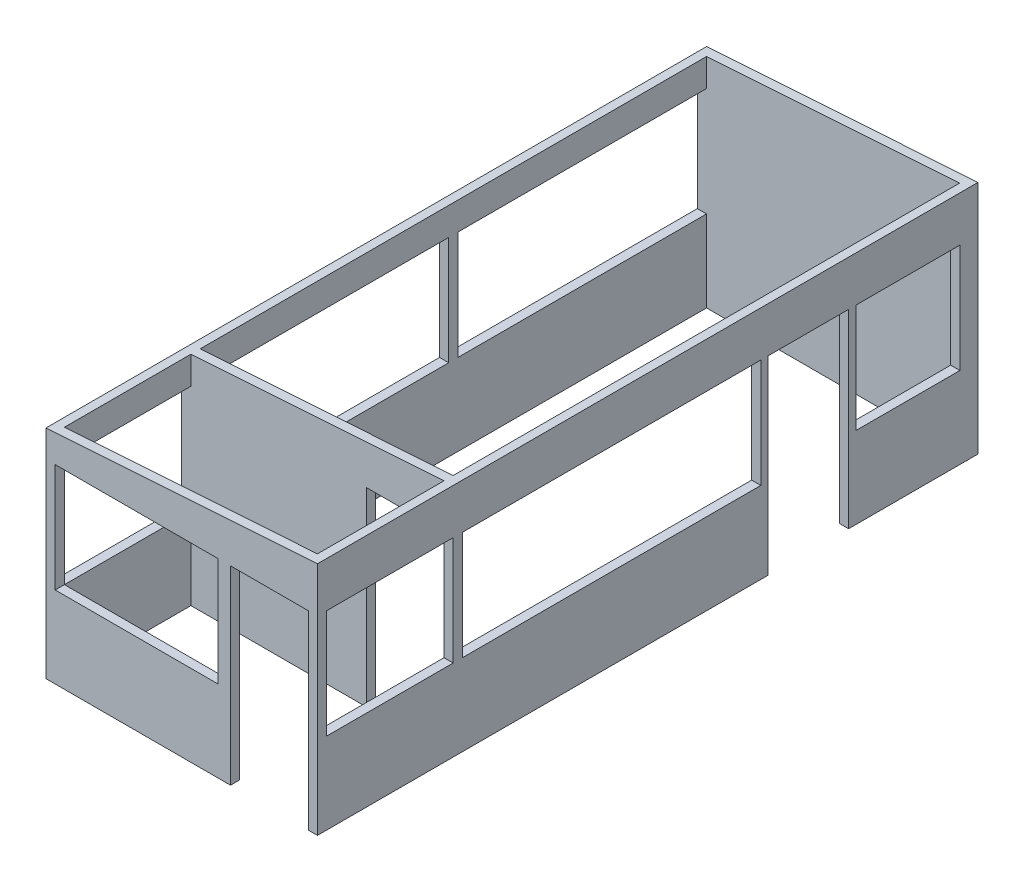
from build123d import *

# Parameters (mm, degrees)
CROQUIS1_W              = 3000
CROQUIS1_H              = 2600
SALIENTE_EXTRUIR1_DEPTH = 5800
CORTAR_EXTRUIR1_DEPTH   = 5800
CROQUIS4_W              = 2747.6
CROQUIS4_H              = 1200
CORTAR_EXTRUIR2_DEPTH   = 101.6
CROQUIS6_W              = 2796.8
CROQUIS6_H              = 5596.8
CORTAR_EXTRUIR5_DEPTH   = 3000
SALIENTE_EXTRUIR3_DEPTH = 1500
CROQUIS14_W             = 2796.8
CROQUIS14_H             = 1398.4
CORTAR_EXTRUIR7_DEPTH   = 3000
CORTAR_EXTRUIR8_REACH   = 8311.633
CROQUIS15_W             = 858.853595779
CROQUIS15_H             = 2100
CROQUIS16_W             = 1398.4
CROQUIS16_H             = 1200
CORTAR_EXTRUIR9_DEPTH   = 200
CROQUIS17_W             = 1797.946404221
CROQUIS17_H             = 1200
CORTAR_EXTRUIR10_DEPTH  = 200
CROQUIS18_W             = 1398.4
CROQUIS18_H             = 1200
CROQUIS18_W_2           = 3298.4
CORTAR_EXTRUIR11_DEPTH  = 200
CROQUIS19_W             = 1150
CROQUIS19_H             = 1200
CORTAR_EXTRUIR12_DEPTH  = 200
CROQUIS20_W             = 890
CROQUIS20_H             = 2100
CORTAR_EXTRUIR13_DEPTH  = 200


with BuildPart() as part:
    # Croquis1 → Saliente-Extruir1 (new body)
    with BuildSketch(Plane.XY):
        with Locations((1500, 1300)):
            Rectangle(CROQUIS1_W, CROQUIS1_H)
    extrude(amount=-SALIENTE_EXTRUIR1_DEPTH)

    # Croquis3 → Cortar-Extruir1 (cut)
    with BuildSketch(Plane.XY):
        Polygon((0, 2600), (0, 2400), (3000, 2600), align=None)
    extrude(amount=-CORTAR_EXTRUIR1_DEPTH, mode=Mode.SUBTRACT)

    # Croquis4 → Cortar-Extruir2 (cut)
    with BuildSketch(Plane.ZY):
        with Locations((-4324.6, 1500)):
            Rectangle(CROQUIS4_W, CROQUIS4_H)
        with Locations((-1475.4, 1500)):
            Rectangle(CROQUIS4_W, CROQUIS4_H)
    extrude(amount=-CORTAR_EXTRUIR2_DEPTH, mode=Mode.SUBTRACT)

    # Croquis6 → Cortar-Extruir5 (cut)
    with BuildSketch(Plane.XZ):
        with Locations((1500, -2900)):
            Rectangle(CROQUIS6_W, CROQUIS6_H)
    extrude(amount=-CORTAR_EXTRUIR5_DEPTH, mode=Mode.SUBTRACT)

    # Croquis13 → Saliente-Extruir3 (add)
    with BuildSketch(Plane.XY):
        Polygon((0, 0), (0, 2400), (3000, 2600), (3000, 0), align=None)
    extrude(amount=SALIENTE_EXTRUIR3_DEPTH)

    # Croquis14 → Cortar-Extruir7 (cut)
    with BuildSketch(Plane.XZ):
        with Locations((1500, 699.2)):
            Rectangle(CROQUIS14_W, CROQUIS14_H)
    extrude(amount=-CORTAR_EXTRUIR7_DEPTH, mode=Mode.SUBTRACT)

    # Cortar-Extruir8: up to this face of the body (flat: up to its plane)
    cortar_extruir8_end = Plane(part.part.faces().sort_by_distance((1492.247795295, 1254.854041559, -101.6))[0])
    # Croquis15 → Cortar-Extruir8 (cut, up to the picked face)
    with BuildSketch(Plane.XY.offset(1500), mode=Mode.PRIVATE) as cortar_extruir8_sk1:
        with Locations((2468.973202111, 1050)):
            Rectangle(CROQUIS15_W, CROQUIS15_H)
    cortar_extruir8_tool1 = split(extrude(cortar_extruir8_sk1.sketch, amount=-CORTAR_EXTRUIR8_REACH, mode=Mode.PRIVATE), bisect_by=cortar_extruir8_end, keep=Keep.BOTH, mode=Mode.PRIVATE)
    add(cortar_extruir8_tool1.solids().sort_by(Axis((2468.973202, 1050, 1500), (0, 0, -1)))[0], mode=Mode.SUBTRACT)

    # Croquis16 → Cortar-Extruir9 (cut)
    with BuildSketch(Plane.ZY):
        with Locations((699.2, 1500)):
            Rectangle(CROQUIS16_W, CROQUIS16_H)
    extrude(amount=-CORTAR_EXTRUIR9_DEPTH, mode=Mode.SUBTRACT)

    # Croquis17 → Cortar-Extruir10 (cut)
    with BuildSketch(Plane.XY.offset(1500)):
        with Locations((1000.573202111, 1500)):
            Rectangle(CROQUIS17_W, CROQUIS17_H)
    extrude(amount=-CORTAR_EXTRUIR10_DEPTH, mode=Mode.SUBTRACT)

    # Croquis18 → Cortar-Extruir11 (cut)
    with BuildSketch(Plane(origin=(3000, 0, 0), x_dir=(0, 0, -1), z_dir=(1, 0, 0))):
        with Locations((-699.2, 1500)):
            Rectangle(CROQUIS18_W, CROQUIS18_H)
        with Locations((1750.8, 1500)):
            Rectangle(CROQUIS18_W_2, CROQUIS18_H)
    extrude(amount=-CORTAR_EXTRUIR11_DEPTH, mode=Mode.SUBTRACT)

    # Croquis19 → Cortar-Extruir12 (cut)
    with BuildSketch(Plane(origin=(3000, 0, 0), x_dir=(0, 0, -1), z_dir=(1, 0, 0))):
        with Locations((5025, 1500)):
            Rectangle(CROQUIS19_W, CROQUIS19_H)
    extrude(amount=-CORTAR_EXTRUIR12_DEPTH, mode=Mode.SUBTRACT)

    # Croquis20 → Cortar-Extruir13 (cut)
    with BuildSketch(Plane(origin=(3000, 0, 0), x_dir=(0, 0, -1), z_dir=(1, 0, 0))):
        with Locations((3925, 1050)):
            Rectangle(CROQUIS20_W, CROQUIS20_H)
    extrude(amount=-CORTAR_EXTRUIR13_DEPTH, mode=Mode.SUBTRACT)


solid = part.part
